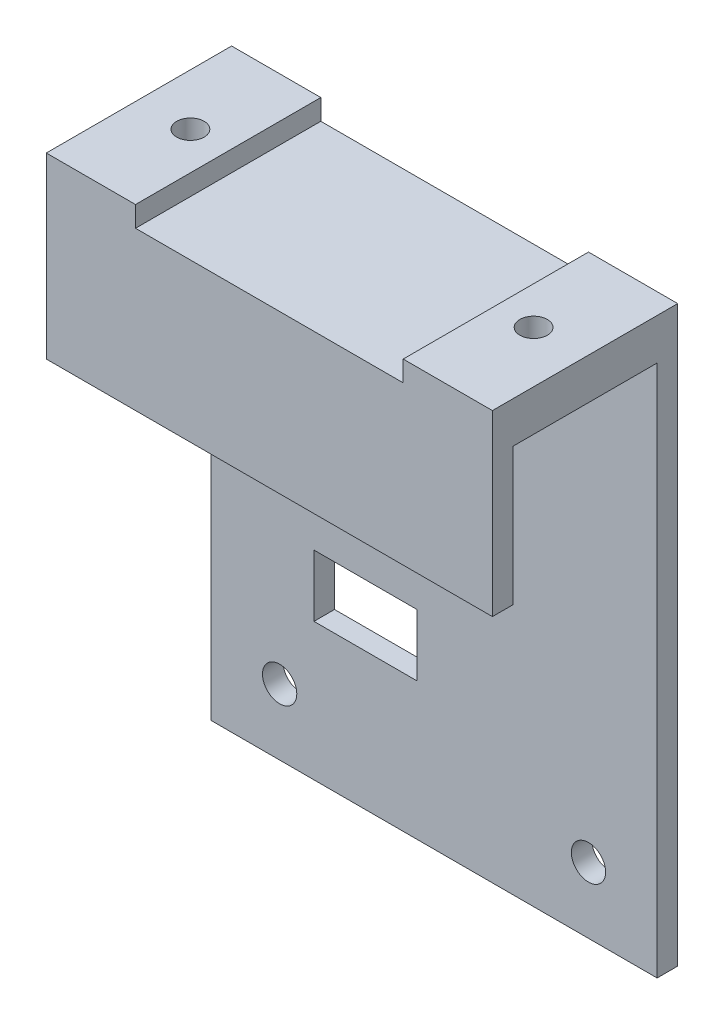
from build123d import *

# Parameters (mm, degrees)
SKETCH_1_W          = 65
SKETCH_1_H          = 70
EXTRUDE_1_DEPTH     = 3
SKETCH_2_W          = 65
SKETCH_2_H          = 6
EXTRUDE_2_DEPTH     = 21
SKETCH_3_W          = 65
SKETCH_3_H          = 3
EXTRUDE_3_DEPTH     = 26
SKETCH_4_W          = 39
SKETCH_4_H          = 3
CUT_EXTRUDE_1_DEPTH = 55.865745233
SKETCH_5_R          = 2
CUT_EXTRUDE_2_DEPTH = 82.76337811
SKETCH_6_W          = 65
SKETCH_6_H          = 3
EXTRUDE_4_DEPTH     = 13.6
SKETCH_7_R          = 2.5
CUT_EXTRUDE_3_DEPTH = 64.199762658
SKETCH_8_W          = 15
SKETCH_8_H          = 9
CUT_EXTRUDE_4_DEPTH = 64.199762658


with BuildPart() as part:
    # 草图1 → 凸台-拉伸1 (new body)
    with BuildSketch(Plane.XY):
        Rectangle(SKETCH_1_W, SKETCH_1_H)
    extrude(amount=EXTRUDE_1_DEPTH)

    # 草图2 → 凸台-拉伸2 (add)
    with BuildSketch(Plane.XY.offset(3)):
        with Locations((0, 32)):
            Rectangle(SKETCH_2_W, SKETCH_2_H)
    extrude(amount=EXTRUDE_2_DEPTH)

    # 草图3 → 凸台-拉伸3 (add)
    with BuildSketch(Plane(origin=(0, 35, 0), x_dir=(1, 0, 0), z_dir=(0, 1, 0))):
        with Locations((0, -25.5)):
            Rectangle(SKETCH_3_W, SKETCH_3_H)
    extrude(amount=-EXTRUDE_3_DEPTH)

    # 草图4 → 切除-拉伸1 (cut, through all)
    with BuildSketch(Plane.XY.offset(27)):
        with Locations((0, 33.5)):
            Rectangle(SKETCH_4_W, SKETCH_4_H)
    extrude(amount=-CUT_EXTRUDE_1_DEPTH, mode=Mode.SUBTRACT)

    # 草图5 → 切除-拉伸2 (cut, through all)
    with BuildSketch(Plane(origin=(0, 35, 0), x_dir=(1, 0, 0), z_dir=(0, 1, 0))):
        with Locations(Location((-25, -13.5, 0), (0, 0, 270))):
            Circle(SKETCH_5_R)
        with Locations(Location((25, -13.5, 0), (0, 0, 270))):
            Circle(SKETCH_5_R)
    extrude(amount=-CUT_EXTRUDE_2_DEPTH, mode=Mode.SUBTRACT)

    # 草图6 → 凸台-拉伸4 (add)
    with BuildSketch(Plane.XZ.offset(35)):
        with Locations((0, 1.5)):
            Rectangle(SKETCH_6_W, SKETCH_6_H)
    extrude(amount=EXTRUDE_4_DEPTH)

    # 草图7 → 切除-拉伸3 (cut, through all)
    with BuildSketch(Plane.XY.offset(3)):
        with Locations((-22.5, -39)):
            Circle(SKETCH_7_R)
        with Locations((22.5, -39)):
            Circle(SKETCH_7_R)
    extrude(amount=-CUT_EXTRUDE_3_DEPTH, mode=Mode.SUBTRACT)

    # 草图8 → 切除-拉伸4 (cut, through all)
    with BuildSketch(Plane.XY.offset(3)):
        with Locations((-10, -24.1)):
            Rectangle(SKETCH_8_W, SKETCH_8_H)
    extrude(amount=-CUT_EXTRUDE_4_DEPTH, mode=Mode.SUBTRACT)


solid = part.part
